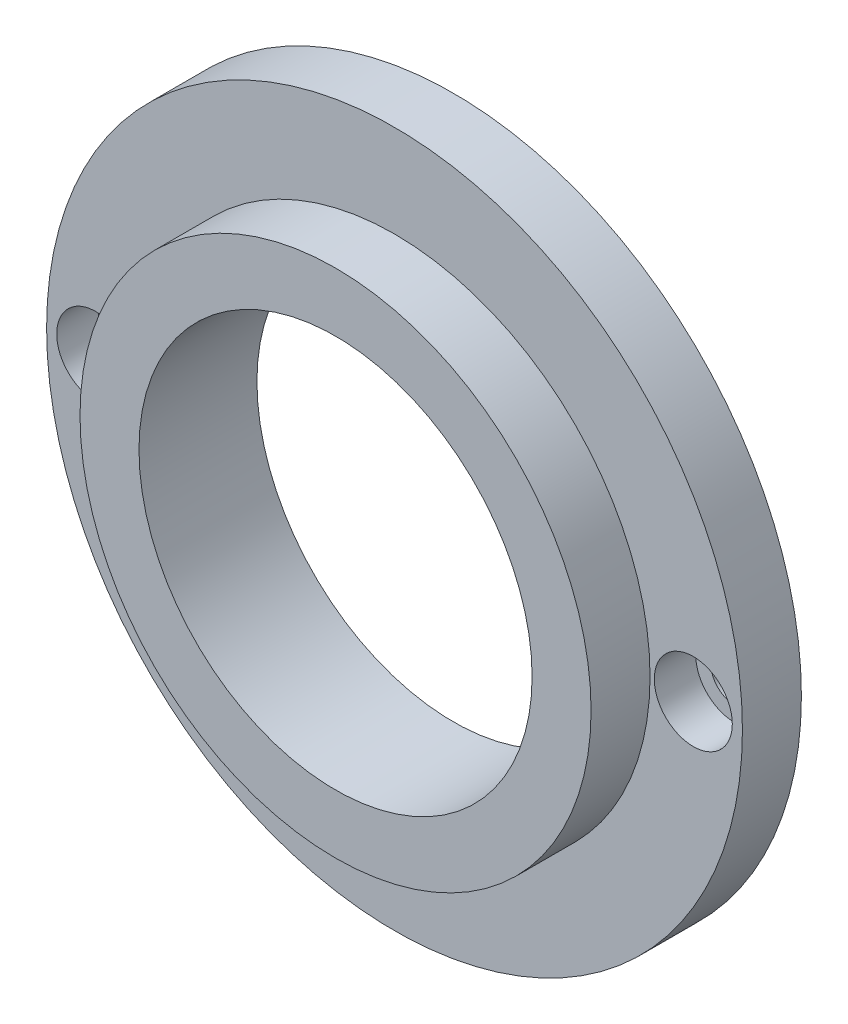
from build123d import *
from build123d.topology import SkipClean

# Parameters (mm, degrees)
ESQUISSE10_R                                        = 13
ESQUISSE10_R_2                                      = 10
BOSS_EXTRU_2_DEPTH                                  = 3
BOSS_EXTRU_3_START                                  = 3
ESQUISSE11_R                                        = 17.7
ESQUISSE11_R_2                                      = 10
BOSS_EXTRU_3_DEPTH                                  = 3
CBORE_FOR_2_FILLISTER_HEAD_MACHINE_SCRE_D           = 2.4384
CBORE_FOR_2_FILLISTER_HEAD_MACHINE_SCRE_CBORE_D     = 3.97002
CBORE_FOR_2_FILLISTER_HEAD_MACHINE_SCRE_CBORE_DEPTH = 2.1082


with BuildPart() as part:
    # Esquisse10 → Boss.-Extru.2 (new body)
    with BuildSketch(Plane.XY):
        Circle(ESQUISSE10_R)
        Circle(ESQUISSE10_R_2, mode=Mode.SUBTRACT)
    extrude(amount=BOSS_EXTRU_2_DEPTH)

    # Esquisse11 → Boss.-Extru.3 (add)
    with SkipClean():  # the faces are left unmerged after this step: merging them gives an invalid solid
        with BuildSketch(Plane(origin=(0, 0, 0), x_dir=(-1, 0, 0), z_dir=(0, 0, -1)).offset(BOSS_EXTRU_3_START)):
            Circle(ESQUISSE11_R)
            Circle(ESQUISSE11_R_2, mode=Mode.SUBTRACT)
        extrude(amount=-BOSS_EXTRU_3_DEPTH)

    # CBORE for #2 Fillister Head Machine Screw1 (through all)
    with Locations(Plane.XY):
        with Locations((-15.2, 0), (15.2, 0)):
            CounterBoreHole(CBORE_FOR_2_FILLISTER_HEAD_MACHINE_SCRE_D / 2, CBORE_FOR_2_FILLISTER_HEAD_MACHINE_SCRE_CBORE_D / 2, CBORE_FOR_2_FILLISTER_HEAD_MACHINE_SCRE_CBORE_DEPTH)


solid = part.part
